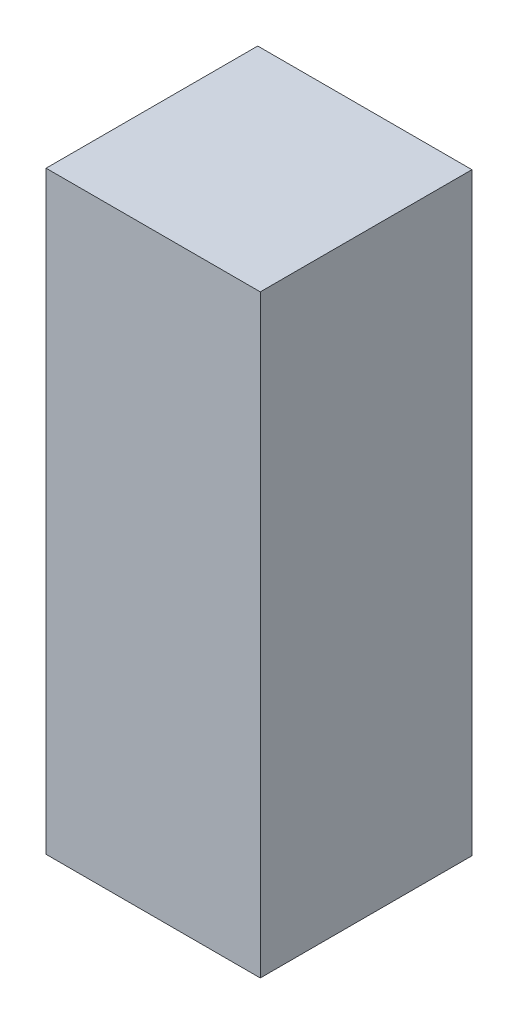
from build123d import *

# Parameters (mm, degrees)
SKETCH1_W           = 10.038558541
SKETCH1_H           = 28.185183595
BOSS_EXTRUDE1_DEPTH = 10.16


with BuildPart() as part:
    # Sketch1 → Boss-Extrude1 (new body)
    with BuildSketch(Plane(origin=(0, 0, 0), x_dir=(0, 0, -1), z_dir=(1, 0, 0))):
        with Locations((-10.183345443, 14.092591798)):
            Rectangle(SKETCH1_W, SKETCH1_H)
    extrude(amount=BOSS_EXTRUDE1_DEPTH)


solid = part.part
